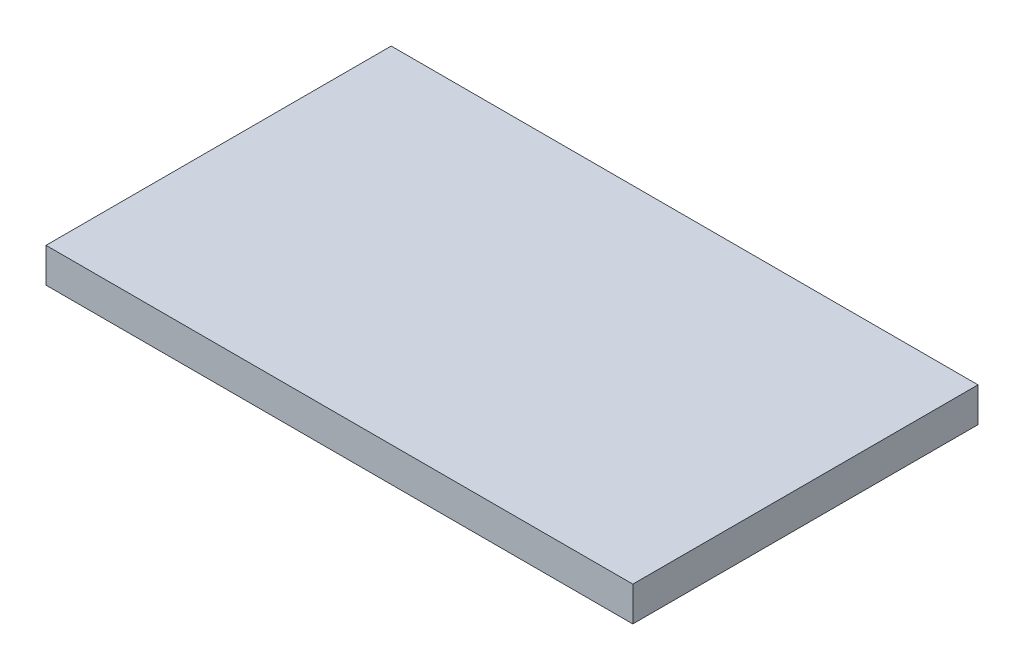
from build123d import *

# Parameters (mm, degrees)
SKETCH1_W           = 170
SKETCH1_H           = 100
BOSS_EXTRUDE1_DEPTH = 10


with BuildPart() as part:
    # Sketch1 → Boss-Extrude1 (new body)
    with BuildSketch(Plane(origin=(0, 0, 0), x_dir=(1, 0, 0), z_dir=(0, 1, 0))):
        Rectangle(SKETCH1_W, SKETCH1_H)
    extrude(amount=BOSS_EXTRUDE1_DEPTH)


solid = part.part
